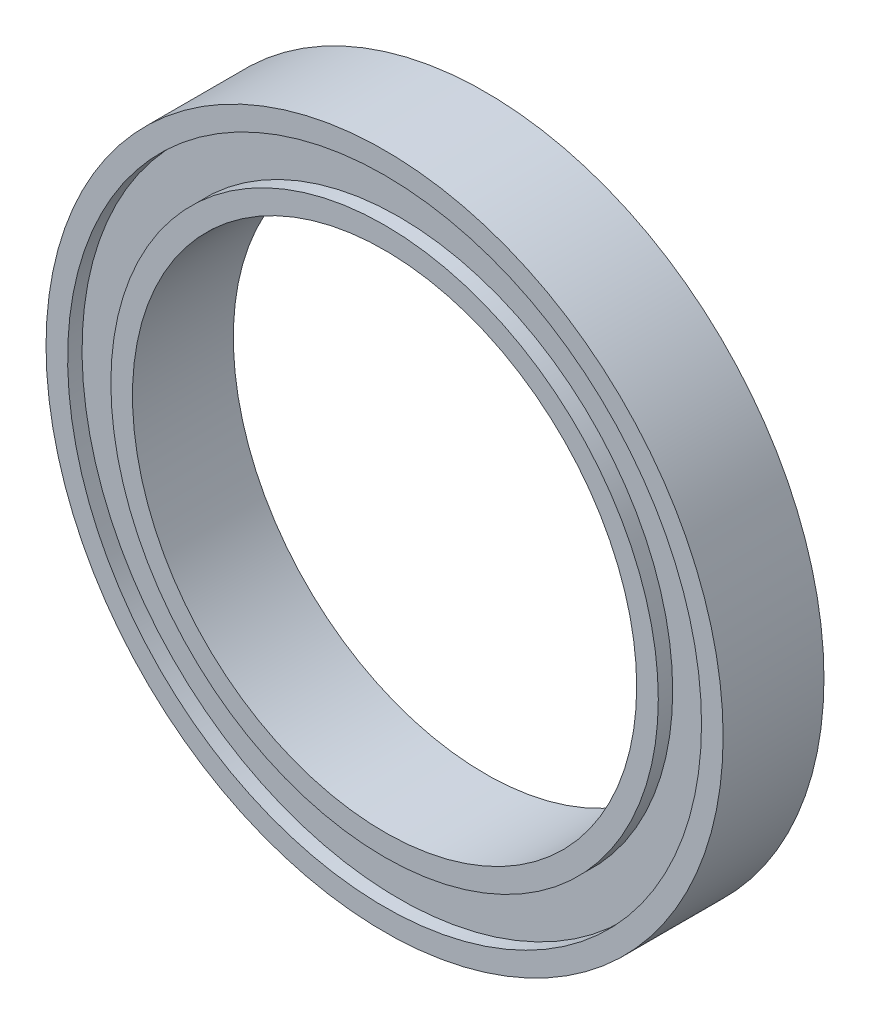
from build123d import *

# Parameters (mm, degrees)
SKETCH1_R               = 23.5
BOSS_EXTRUDE1_DEPTH     = 7
SKETCH2_R               = 17.5
CUT_EXTRUDE1_DEPTH      = 34.963215395
SKETCH3_R               = 22
SKETCH3_R_2             = 19
CUT_EXTRUDE_THIN1_DEPTH = 34.963215395
EXTRUDE_THIN1_START     = 1
SKETCH4_R               = 22
SKETCH4_R_2             = 19
EXTRUDE_THIN1_DEPTH     = 5


with BuildPart() as part:
    # Sketch1 → Boss-Extrude1 (new body)
    with BuildSketch(Plane(origin=(0, 0, 0), x_dir=(0, 1, 0), z_dir=(0, 0, 1))):
        with Locations(Location((0, 0, 0), (0, 0, 270))):
            Circle(SKETCH1_R)
    extrude(amount=BOSS_EXTRUDE1_DEPTH)

    # Sketch2 → Cut-Extrude1 (cut, through all)
    with BuildSketch(Plane(origin=(0, 0, 0), x_dir=(0, 1, 0), z_dir=(0, 0, 1))):
        with Locations(Location((0, 0, 0), (0, 0, 270))):
            Circle(SKETCH2_R)
    extrude(amount=CUT_EXTRUDE1_DEPTH, mode=Mode.SUBTRACT)

    # Sketch3 → Cut-Extrude-Thin1 (cut, through all)
    with BuildSketch(Plane(origin=(0, 0, 0), x_dir=(1, 0, 0), z_dir=(0, 0, -1))):
        Circle(SKETCH3_R)
        Circle(SKETCH3_R_2, mode=Mode.SUBTRACT)
    extrude(amount=-CUT_EXTRUDE_THIN1_DEPTH, mode=Mode.SUBTRACT)


with BuildPart() as cut_extrude_thin1_piece_1:
    # of the separate pieces the step leaves, piece 1, a body of its own (cut_extrude_thin1_pieces)
    add(part.part.solids().sort_by_distance((23.5, 0, 0))[0])



with BuildPart() as cut_extrude_thin1_piece_2:
    # of the separate pieces the step leaves, piece 2, a body of its own (cut_extrude_thin1_pieces)
    add(part.part.solids().sort_by_distance((19, 0, 0))[0])


with BuildPart() as cut_extrude_thin1_piece_1_1:
    add(cut_extrude_thin1_piece_1.part)

    add(cut_extrude_thin1_piece_2.part)  # Extrude-Thin1 merges Cut-Extrude-Thin1 piece 2
    # Sketch4 → Extrude-Thin1 (add)
    with BuildSketch(Plane(origin=(0, 0, 0), x_dir=(0, 1, 0), z_dir=(0, 0, 1)).offset(EXTRUDE_THIN1_START)):
        Circle(SKETCH4_R)
        Circle(SKETCH4_R_2, mode=Mode.SUBTRACT)
    extrude(amount=EXTRUDE_THIN1_DEPTH)


solid = cut_extrude_thin1_piece_1_1.part
